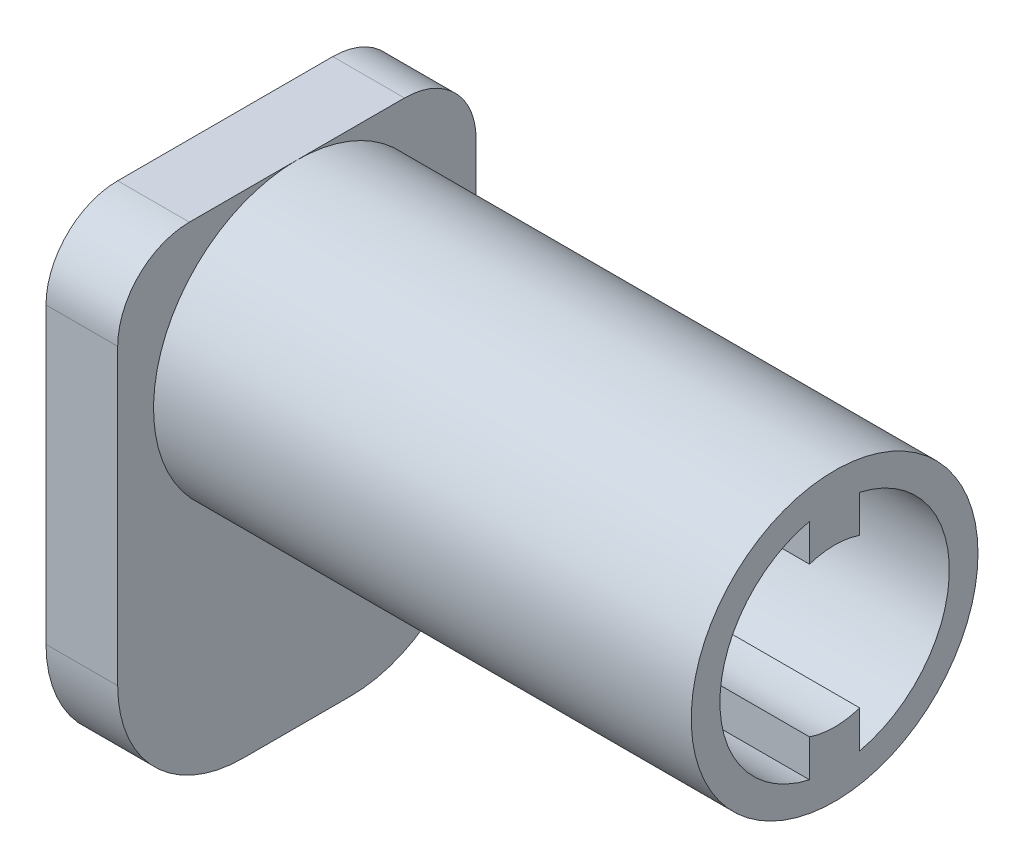
from build123d import *

# Parameters (mm, degrees)
SKETCH2_R           = 4
BOSS_EXTRUDE1_DEPTH = 15
SKETCH3_W           = 10
SKETCH3_H           = 13.7
BOSS_EXTRUDE2_DEPTH = 2
SKETCH4_R           = 3.2
CUT_EXTRUDE1_DEPTH  = 15
SKETCH7_R           = 1.6
CUT_EXTRUDE4_DEPTH  = 21.201237586
BOSS_EXTRUDE3_START = -17
BOSS_EXTRUDE3_DEPTH = 17
FILLET2_R           = 2
FILLET3_R           = 3.5


with BuildPart() as part:
    # Sketch2 → Boss-Extrude1 (new body)
    with BuildSketch(Plane(origin=(0, 0, 0), x_dir=(0, 0, -1), z_dir=(1, 0, 0))):
        Circle(SKETCH2_R)
    extrude(amount=-BOSS_EXTRUDE1_DEPTH)

    # Sketch3 → Boss-Extrude2 (add)
    with BuildSketch(Plane.ZY.offset(15)):
        with Locations((0, -2.85)):
            Rectangle(SKETCH3_W, SKETCH3_H)
    extrude(amount=BOSS_EXTRUDE2_DEPTH)

    # Sketch4 → Cut-Extrude1 (cut)
    with BuildSketch(Plane(origin=(0, 0, 0), x_dir=(0, 0, -1), z_dir=(1, 0, 0))):
        Circle(SKETCH4_R)
    extrude(amount=-CUT_EXTRUDE1_DEPTH, mode=Mode.SUBTRACT)

    # Sketch7 → Cut-Extrude4 (cut, through all)
    with BuildSketch(Plane.ZY.offset(17)):
        Circle(SKETCH7_R)
    extrude(amount=-CUT_EXTRUDE4_DEPTH, mode=Mode.SUBTRACT)

    # Sketch6 → Boss-Extrude3 (add)
    with BuildSketch(Plane.ZY.offset(17).offset(BOSS_EXTRUDE3_START)):
        with BuildLine():
            Line((0.7, -2.861817604), (0.7, -2.085665361))
            ThreePointArc((0.7, -2.085665361), (0, -2.2), (-0.7, -2.085665361))
            Line((-0.7, -2.085665361), (-0.7, -2.861817604))
            Line((-0.7, -2.861817604), (-0.7, -3.122498999))
            ThreePointArc((-0.7, -3.122498999), (0, -3.2), (0.7, -3.122498999))
            Line((0.7, -3.122498999), (0.7, -2.861817604))
        make_face()
        with BuildLine():
            Line((-0.7, 2.085665361), (-0.7, 2.861817604))
            Line((-0.7, 2.861817604), (-0.7, 3.122498999))
            ThreePointArc((-0.7, 3.122498999), (0, 3.2), (0.7, 3.122498999))
            Line((0.7, 3.122498999), (0.7, 2.861817604))
            Line((0.7, 2.861817604), (0.7, 2.085665361))
            ThreePointArc((0.7, 2.085665361), (0, 2.2), (-0.7, 2.085665361))
        make_face()
    extrude(amount=BOSS_EXTRUDE3_DEPTH)

    # Fillet2
    fillet2_edges = [part.edges().sort_by_distance(p)[0] for p in [
        (-16, 4, -5),
        (-16, 4, 5),
    ]]
    fillet(fillet2_edges, radius=FILLET2_R)

    # Fillet3
    fillet3_edges = [part.edges().sort_by_distance(p)[0] for p in [
        (-16, -9.7, -5),
        (-16, -9.7, 5),
    ]]
    fillet(fillet3_edges, radius=FILLET3_R)


solid = part.part
